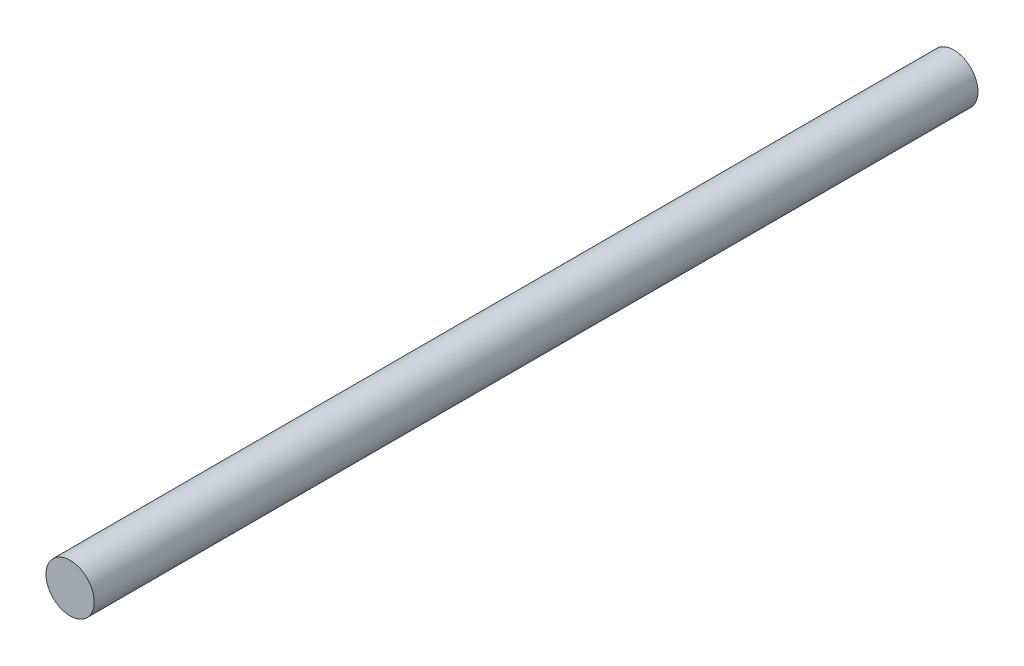
from build123d import *

# Parameters (mm, degrees)
SKETCH1_R           = 8
BOSS_EXTRUDE1_DEPTH = 293


with BuildPart() as part:
    # Sketch1 → Boss-Extrude1 (new body)
    with BuildSketch(Plane.XY):
        Circle(SKETCH1_R)
    extrude(amount=BOSS_EXTRUDE1_DEPTH)


solid = part.part
